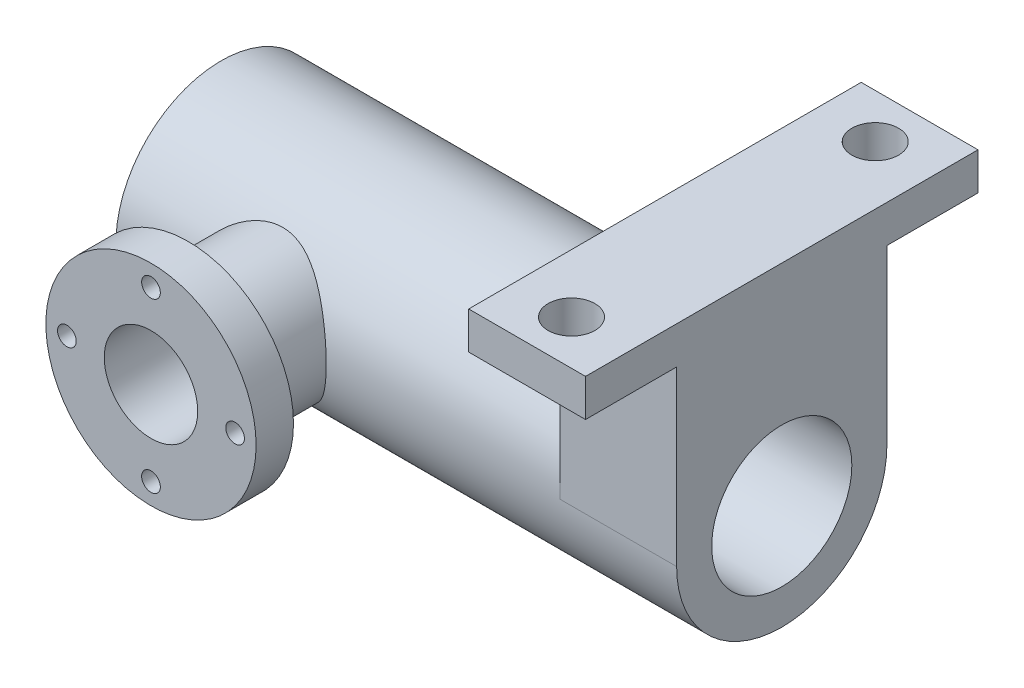
from build123d import *

# Parameters (mm, degrees)
SKETCH_1_R          = 22.5
SKETCH_1_R_2        = 15
EXTRUDE_1_DEPTH     = 120
EXTRUDE_START       = 45
SKETCH_2_W          = 25
SKETCH_2_H          = 84
SKETCH_2_R          = 5
EXTRUDE_5_DEPTH     = 8
EXTRUDE_6_REACH     = 173.867
EXTRUDE_START_2     = 37
SKETCH_3_R          = 22.5
SKETCH_3_R_2        = 10
EXTRUDE_7_DEPTH     = 8
EXTRUDE_8_REACH     = 174.831
SKETCH_3_3_R        = 15
SKETCH_3_3_R_2      = 10
CUT_EXTRUDE_1_REACH = 137.831
SKETCH_3_4_R        = 10
CUT_EXTRUDE_2_REACH = 156.9
SKETCH_4_R          = 2


with BuildPart() as part:
    # 草图1 → 凸台-拉伸1 (new body)
    with BuildSketch(Plane(origin=(0, 0, 0), x_dir=(0, 0, -1), z_dir=(1, 0, 0))):
        Circle(SKETCH_1_R)
        Circle(SKETCH_1_R_2, mode=Mode.SUBTRACT)
    extrude(amount=EXTRUDE_1_DEPTH)

    # 草图2<7> → 凸台-拉伸6 (add, up to next)
    with BuildSketch(Plane(origin=(0, 0, 0), x_dir=(1, 0, 0), z_dir=(0, 1, 0)).offset(EXTRUDE_START_2), mode=Mode.PRIVATE) as extrude_6_sk1:
        Polygon((95, -22.5), (120, -22.5), (120, 22.5), (95, 22.5), (95, 15), (107.5, 15), (107.5, -15), (95, -15), align=None)
    extrude_6_tool1 = extrude(extrude_6_sk1.sketch, amount=-EXTRUDE_6_REACH, mode=Mode.PRIVATE) - part.part


with BuildPart() as body_2:
    # 草图2 → 凸台-拉伸5 (new body)
    with BuildSketch(Plane(origin=(0, 0, 0), x_dir=(1, 0, 0), z_dir=(0, 1, 0)).offset(EXTRUDE_START)):
        with Locations((107.5, 0)):
            Rectangle(SKETCH_2_W, SKETCH_2_H)
        with Locations((107.5, -32.5)):
            Circle(SKETCH_2_R, mode=Mode.SUBTRACT)
        with Locations((107.5, 32.5)):
            Circle(SKETCH_2_R, mode=Mode.SUBTRACT)
    extrude(amount=-EXTRUDE_5_DEPTH)


with BuildPart() as part_1:
    add(part.part)

    add(body_2.part)  # 凸台-拉伸6 merges body 2
    add(extrude_6_tool1.solids().sort_by_distance((110.625, 37, 0))[0])

    # 草图3<3> → 凸台-拉伸8 (add, up to next)
    with BuildSketch(Plane.XY.offset(EXTRUDE_START_2), mode=Mode.PRIVATE) as extrude_8_sk1:
        with Locations((30, 0)):
            Circle(SKETCH_3_3_R)
        with Locations((30, 0)):
            Circle(SKETCH_3_3_R_2, mode=Mode.SUBTRACT)
    extrude_8_tool1 = extrude(extrude_8_sk1.sketch, amount=-EXTRUDE_8_REACH, mode=Mode.PRIVATE) - part_1.part


with BuildPart() as body_2_2:
    # 草图3 → 凸台-拉伸7 (new body)
    with BuildSketch(Plane.XY.offset(EXTRUDE_START)):
        with Locations((30, 0)):
            Circle(SKETCH_3_R)
        with Locations((30, 0)):
            Circle(SKETCH_3_R_2, mode=Mode.SUBTRACT)
    extrude(amount=-EXTRUDE_7_DEPTH)


with BuildPart() as part_2:
    add(part_1.part)

    add(body_2_2.part)  # 凸台-拉伸8 merges body 2 2
    add(extrude_8_tool1.solids().sort_by_distance((15.424264, 0, 37))[0])

    # 草图3<4> → 切除-拉伸1 (cut, up to next)
    with BuildSketch(Plane.XY, mode=Mode.PRIVATE) as cut_extrude_1_sk1:
        with Locations((30, 0)):
            Circle(SKETCH_3_4_R)
    cut_extrude_1_tool1 = extrude(cut_extrude_1_sk1.sketch, amount=CUT_EXTRUDE_1_REACH, mode=Mode.PRIVATE) & part_2.part
    add(cut_extrude_1_tool1.solids().sort_by_distance((30, 0, 0))[0], mode=Mode.SUBTRACT)

    # 草图4 → 切除-拉伸2 (cut, up to next)
    with BuildSketch(Plane.XY.offset(45), mode=Mode.PRIVATE) as cut_extrude_2_sk1:
        with Locations((30, 18)):
            Circle(SKETCH_4_R)
    cut_extrude_2_tool1 = extrude(cut_extrude_2_sk1.sketch, amount=-CUT_EXTRUDE_2_REACH, mode=Mode.PRIVATE) & part_2.part
    # 草图4 → 切除-拉伸2 (cut, up to next)
    with BuildSketch(Plane.XY.offset(45), mode=Mode.PRIVATE) as cut_extrude_2_sk2:
        with Locations((48, 0)):
            Circle(SKETCH_4_R)
    cut_extrude_2_tool2 = extrude(cut_extrude_2_sk2.sketch, amount=-CUT_EXTRUDE_2_REACH, mode=Mode.PRIVATE) & part_2.part
    # 草图4 → 切除-拉伸2 (cut, up to next)
    with BuildSketch(Plane.XY.offset(45), mode=Mode.PRIVATE) as cut_extrude_2_sk3:
        with Locations((30, -18)):
            Circle(SKETCH_4_R)
    cut_extrude_2_tool3 = extrude(cut_extrude_2_sk3.sketch, amount=-CUT_EXTRUDE_2_REACH, mode=Mode.PRIVATE) & part_2.part
    # 草图4 → 切除-拉伸2 (cut, up to next)
    with BuildSketch(Plane.XY.offset(45), mode=Mode.PRIVATE) as cut_extrude_2_sk4:
        with Locations((12, 0)):
            Circle(SKETCH_4_R)
    cut_extrude_2_tool4 = extrude(cut_extrude_2_sk4.sketch, amount=-CUT_EXTRUDE_2_REACH, mode=Mode.PRIVATE) & part_2.part
    add(cut_extrude_2_tool1.solids().sort_by_distance((30, 18, 45))[0], mode=Mode.SUBTRACT)
    add(cut_extrude_2_tool2.solids().sort_by_distance((48, 0, 45))[0], mode=Mode.SUBTRACT)
    add(cut_extrude_2_tool3.solids().sort_by_distance((30, -18, 45))[0], mode=Mode.SUBTRACT)
    add(cut_extrude_2_tool4.solids().sort_by_distance((12, 0, 45))[0], mode=Mode.SUBTRACT)


solid = part_2.part
